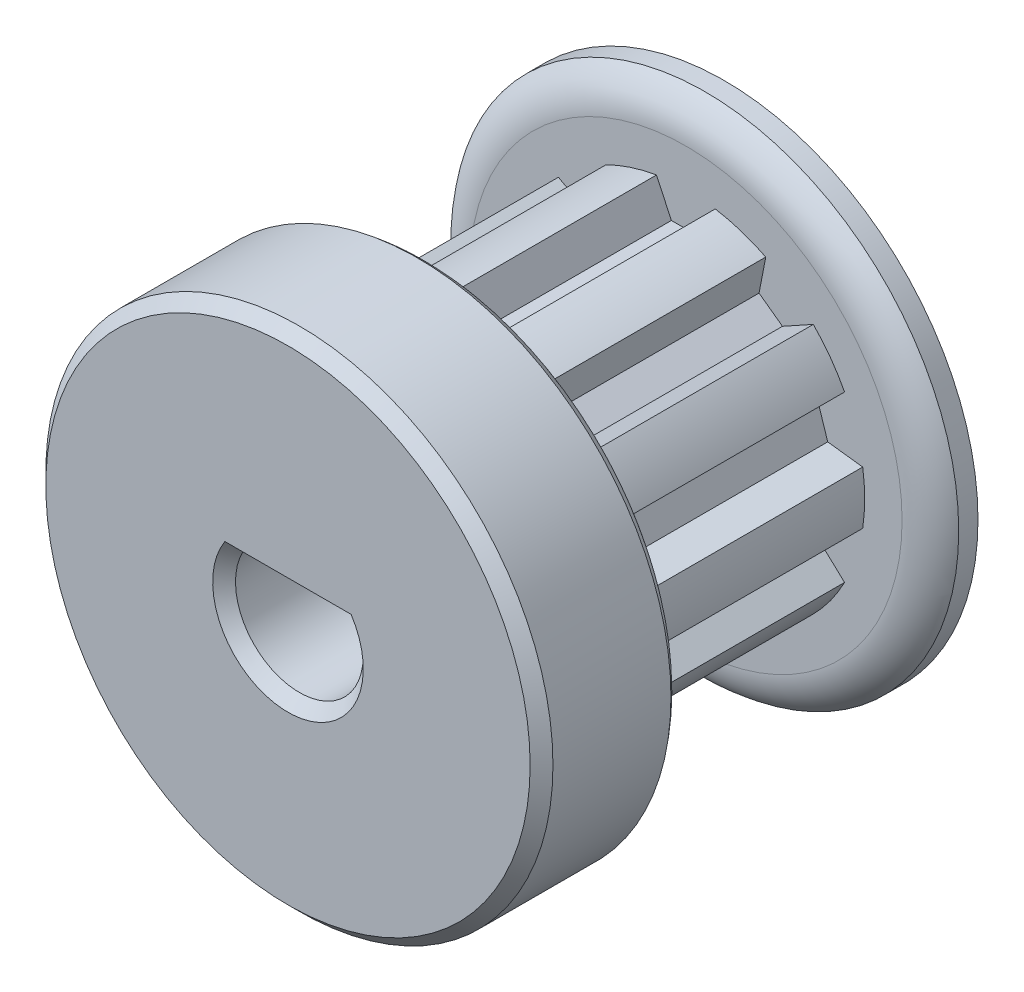
from build123d import *

# Parameters (mm, degrees)
CUT_EXTRUDE1_START  = 2.2987
CUT_EXTRUDE1_DEPTH  = 10.922
CIRPATTERN1_COUNT   = 10
BOSS_EXTRUDE1_START = -7.62
BOSS_EXTRUDE1_DEPTH = 7.62
CUT_EXTRUDE2_DEPTH  = 6.6802
BOSS_EXTRUDE2_START = 4.826
SKETCH8_R           = 11.1125
BOSS_EXTRUDE2_DEPTH = 4.826
CUT_EXTRUDE3_DEPTH  = 24.384
CHAMFER2_SIZE       = 0.5


with BuildPart() as part:
    # Sketch2 → Revolve1 (revolve)
    with BuildSketch(Plane(origin=(0, 0, 0), x_dir=(0, 0, -1), z_dir=(1, 0, 0)), mode=Mode.PRIVATE) as revolve1_sk:
        with BuildLine():
            Line((-3.9878, 2.5), (10.3124, 2.5))
            Line((10.3124, 2.5), (10.3124, 11.1125))
            Line((10.3124, 11.1125), (9.46785, 11.1125))
            ThreePointArc((9.46785, 11.1125), (8.846862309, 10.395787163), (8.6233, 9.4742))
            Line((8.6233, 9.4742), (8.6233, 7.8359))
            Line((8.6233, 7.8359), (-2.2987, 7.8359))
            Line((-2.2987, 7.8359), (-2.2987, 9.4742))
            ThreePointArc((-2.2987, 9.4742), (-2.522262309, 10.395787163), (-3.14325, 11.1125))
            Line((-3.14325, 11.1125), (-3.9878, 11.1125))
            Line((-3.9878, 11.1125), (-3.9878, 2.5))
        make_face()
    revolve(revolve1_sk.sketch.rotate(Axis((0, 0, 10.3124), (0, 0, -1)), 90), axis=Axis((0, 0, 10.3124), (0, 0, -1)))

    # Sketch3 → Cut-Extrude1 (cut)
    with BuildSketch(Plane.XY.offset(CUT_EXTRUDE1_START)):
        with BuildLine():
            Line((-0.635, 6.329348022), (0.635, 6.329348022))
            Line((0.635, 6.329348022), (1.287830721, 7.729348022))
            ThreePointArc((1.287830721, 7.729348022), (0, 7.8359), (-1.287830721, 7.729348022))
            Line((-1.287830721, 7.729348022), (-0.635, 6.329348022))
        make_face()
    cut_extrude1 = extrude(amount=-CUT_EXTRUDE1_DEPTH, mode=Mode.SUBTRACT)

    # CirPattern1: Cut-Extrude1 ×10 about axis
    cirpattern1_axis = Axis((0, 0, 0), (0, 0, 1))
    for i in range(1, CIRPATTERN1_COUNT):
        add(cut_extrude1.rotate(cirpattern1_axis, i * 360 / CIRPATTERN1_COUNT), mode=Mode.SUBTRACT)

    # Sketch5 → Boss-Extrude1 (add)
    with BuildSketch(Plane.XY.offset(3.9878).offset(BOSS_EXTRUDE1_START)):
        with BuildLine():
            Line((-2.291287847, 1), (2.291287847, 1))
            ThreePointArc((2.291287847, 1), (0, 2.5), (-2.291287847, 1))
        make_face()
    extrude(amount=BOSS_EXTRUDE1_DEPTH)

    # Sketch6 → Cut-Extrude2 (cut)
    with BuildSketch(Plane(origin=(0, 0, -10.3124), x_dir=(-1, 0, 0), z_dir=(0, 0, -1))):
        Polygon((5.672466395, 0), (2.836233197, 4.9125), (-2.836233197, 4.9125), (-5.672466395, 0), (-2.836233197, -4.9125), (2.836233197, -4.9125), align=None)
    extrude(amount=-CUT_EXTRUDE2_DEPTH, mode=Mode.SUBTRACT)

    # Sketch8 → Boss-Extrude2 (add)
    with BuildSketch(Plane.XY.offset(3.9878).offset(BOSS_EXTRUDE2_START)):
        Circle(SKETCH8_R)
        with BuildLine():
            Line((2.291287847, 1), (-2.291287847, 1))
            ThreePointArc((-2.291287847, 1), (0, -2.5), (2.291287847, 1))
        make_face(mode=Mode.SUBTRACT)
    extrude(amount=-BOSS_EXTRUDE2_DEPTH)

    # Sketch12 → Cut-Extrude3 (cut)
    with BuildSketch(Plane.XY.offset(8.8138)):
        with BuildLine():
            Line((2.479919354, 1.3), (-2.479919354, 1.3))
            ThreePointArc((-2.479919354, 1.3), (0, -2.8), (2.479919354, 1.3))
        make_face()
    extrude(amount=-CUT_EXTRUDE3_DEPTH, mode=Mode.SUBTRACT)

    # Chamfer2
    chamfer2_edges = [part.edges().sort_by_distance(p)[0] for p in [
        (-11.1125, 0, 8.8138),
        (0, -2.8, 8.8138),
        (0, 1.3, 8.8138),
    ]]
    chamfer(chamfer2_edges, length=CHAMFER2_SIZE)


solid = part.part
